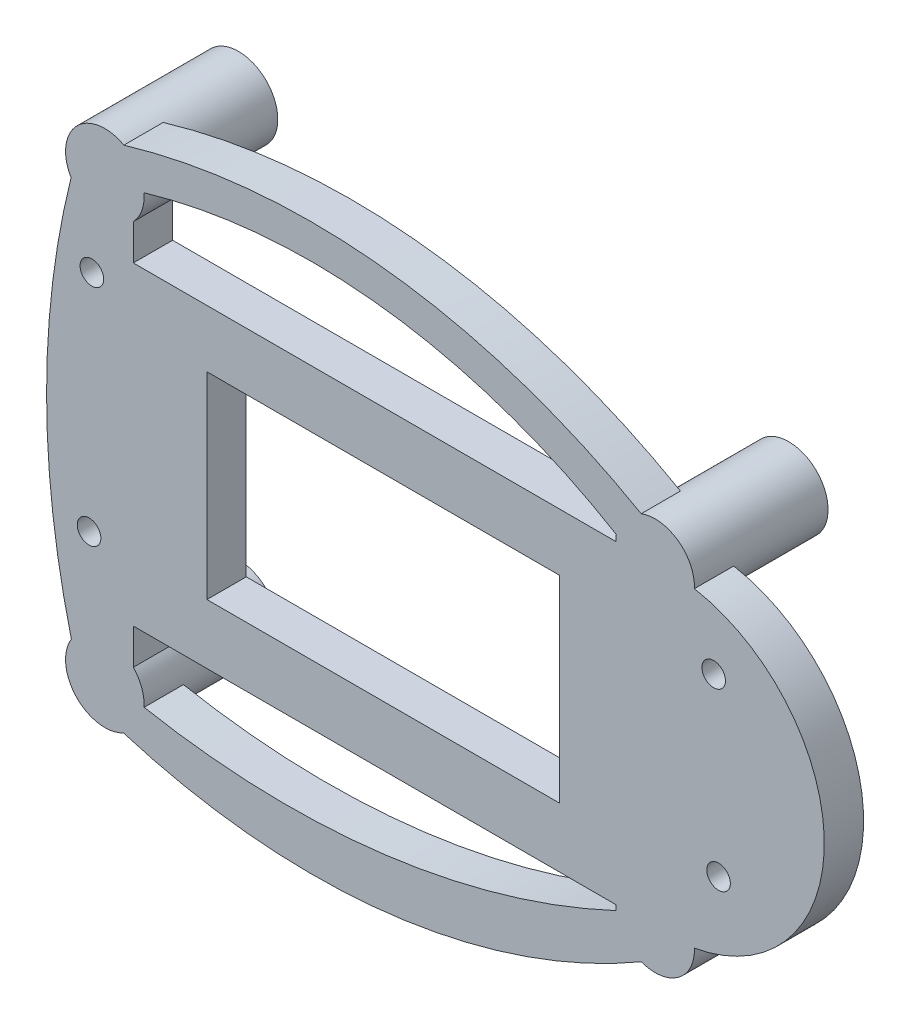
from build123d import *

# Parameters (mm, degrees)
SKETCH1_R                       = 2.6
SKETCH1_R_2                     = 1.5
SKETCH1_W                       = 44.817241247
SKETCH1_H                       = 25.097655098
BOSS_EXTRUDE1_DEPTH             = 5
SKETCH2_R                       = 5
SKETCH2_R_2                     = 2.6
BOSS_EXTRUDE2_DEPTH             = 12
BOSS_EXTRUDE2_DIRECTION_2_REACH = 102.099
BOSS_EXTRUDE3_START             = -10
SKETCH3_R                       = 2.6
BOSS_EXTRUDE3_DEPTH             = 10


with BuildPart() as part:
    # Sketch1 → Boss-Extrude1 (new body)
    with BuildSketch(Plane.XY):
        with BuildLine():
            ThreePointArc((-87.127451531, -22.124820062), (-86.163911981, -24.765644938), (-83.600914186, -25.920377287))
            ThreePointArc((-83.600914186, -25.920377287), (-47.661538714, -29.763777863), (-13.512307499, -17.921462012))
            ThreePointArc((-13.512307499, -17.921462012), (-10.952947302, -16.861340184), (-9.892825615, -14.301979929))
            ThreePointArc((-9.892825615, -14.301979929), (8.007659225, 5.698020071), (-9.892825615, 25.698020071))
            ThreePointArc((-9.892825615, 25.698020071), (-10.952947373, 28.257380397), (-13.512307698, 29.317502154))
            ThreePointArc((-13.512307698, 29.317502154), (-47.63265011, 41.014505592), (-83.512307597, 37.317502154))
            ThreePointArc((-83.512307597, 37.317502154), (-86.071667988, 36.257380433), (-87.131789782, 33.698020071))
            ThreePointArc((-87.131789782, 33.698020071), (-90.927012387, 5.786304892), (-87.127451531, -22.124820062))
        make_face()
        with Locations((-83.512307698, -22.301979929)):
            Circle(SKETCH1_R, mode=Mode.SUBTRACT)
        with Locations((-83.512307698, 33.698020071)):
            Circle(SKETCH1_R, mode=Mode.SUBTRACT)
        with Locations((-13.512307698, 25.698020071)):
            Circle(SKETCH1_R, mode=Mode.SUBTRACT)
        with Locations((-13.512307698, -14.301979929)):
            Circle(SKETCH1_R, mode=Mode.SUBTRACT)
        with Locations((-85.16722268, 22.0113147)):
            Circle(SKETCH1_R_2, mode=Mode.SUBTRACT)
        with Locations((-85.523935714, -6.702744554)):
            Circle(SKETCH1_R_2, mode=Mode.SUBTRACT)
        with Locations((-6.064210345, 17.314888474)):
            Circle(SKETCH1_R_2, mode=Mode.SUBTRACT)
        with Locations((-5.445296778, -4.691116539)):
            Circle(SKETCH1_R_2, mode=Mode.SUBTRACT)
        with BuildLine():
            Line((-79.892825615, -14.301980328), (-79.892825615, -22.301979929))
            ThreePointArc((-79.892825615, -22.301979929), (-47.851158005, -23.48878534), (-17.131789782, -14.301980328))
            Line((-17.131789782, -14.301980328), (-79.892825615, -14.301980328))
        make_face(mode=Mode.SUBTRACT)
        with BuildLine():
            Line((-79.892825615, 33.698019868), (-79.892825615, 25.698020071))
            Line((-79.892825615, 25.698020071), (-17.131789782, 25.698020071))
            ThreePointArc((-17.131789782, 25.698020071), (-47.634119077, 36.587523584), (-79.892825615, 33.698019868))
        make_face(mode=Mode.SUBTRACT)
        with Locations((-48.117941597, 5.846082995)):
            Rectangle(SKETCH1_W, SKETCH1_H, mode=Mode.SUBTRACT)
    extrude(amount=BOSS_EXTRUDE1_DEPTH)

    # Sketch2 → Boss-Extrude2 (add)
    # profile 1 of 4: a face of its own
    with BuildSketch(Plane(origin=(0, 0, 0), x_dir=(-1, 0, 0), z_dir=(0, 0, -1))):
        with Locations((13.512307698, 25.698020071)):
            Circle(SKETCH2_R)
        with Locations((13.512307698, 25.698020071)):
            Circle(SKETCH2_R_2, mode=Mode.SUBTRACT)
    # profile 2 of 4: a face of its own
    with BuildSketch(Plane(origin=(0, 0, 0), x_dir=(-1, 0, 0), z_dir=(0, 0, -1))):
        with Locations((83.512307698, 33.698020071)):
            Circle(SKETCH2_R)
        with Locations((83.512307698, 33.698020071)):
            Circle(SKETCH2_R_2, mode=Mode.SUBTRACT)
    # profile 3 of 4: a face of its own
    with BuildSketch(Plane(origin=(0, 0, 0), x_dir=(-1, 0, 0), z_dir=(0, 0, -1))):
        with Locations((83.512307698, -22.301979929)):
            Circle(SKETCH2_R)
        with Locations((83.512307698, -22.301979929)):
            Circle(SKETCH2_R_2, mode=Mode.SUBTRACT)
    # profile 4 of 4: a face of its own
    with BuildSketch(Plane(origin=(0, 0, 0), x_dir=(-1, 0, 0), z_dir=(0, 0, -1))):
        with Locations((13.512307698, -14.301979929)):
            Circle(SKETCH2_R)
        with Locations((13.512307698, -14.301979929)):
            Circle(SKETCH2_R_2, mode=Mode.SUBTRACT)
    extrude(amount=BOSS_EXTRUDE2_DEPTH)

    # Boss-Extrude2 direction 2: up to this face of the body (flat: up to its plane)
    boss_extrude2_direction_2_end = Plane(part.part.faces().sort_by_distance((-86.07433416, -24.682416176, 5))[0])
    # Sketch2 → Boss-Extrude2 direction 2 (add, up to the picked face)
    with BuildSketch(Plane(origin=(0, 0, 0), x_dir=(-1, 0, 0), z_dir=(0, 0, -1)), mode=Mode.PRIVATE) as boss_extrude2_direction_2_sk1:
        with Locations((13.512307698, 25.698020071)):
            Circle(SKETCH2_R)
        with Locations((13.512307698, 25.698020071)):
            Circle(SKETCH2_R_2, mode=Mode.SUBTRACT)
    boss_extrude2_direction_2_tool1 = split(extrude(boss_extrude2_direction_2_sk1.sketch, amount=-BOSS_EXTRUDE2_DIRECTION_2_REACH, mode=Mode.PRIVATE), bisect_by=boss_extrude2_direction_2_end, keep=Keep.BOTH, mode=Mode.PRIVATE)
    # Sketch2 → Boss-Extrude2 direction 2 (add, up to the picked face)
    with BuildSketch(Plane(origin=(0, 0, 0), x_dir=(-1, 0, 0), z_dir=(0, 0, -1)), mode=Mode.PRIVATE) as boss_extrude2_direction_2_sk2:
        with Locations((83.512307698, 33.698020071)):
            Circle(SKETCH2_R)
        with Locations((83.512307698, 33.698020071)):
            Circle(SKETCH2_R_2, mode=Mode.SUBTRACT)
    boss_extrude2_direction_2_tool2 = split(extrude(boss_extrude2_direction_2_sk2.sketch, amount=-BOSS_EXTRUDE2_DIRECTION_2_REACH, mode=Mode.PRIVATE), bisect_by=boss_extrude2_direction_2_end, keep=Keep.BOTH, mode=Mode.PRIVATE)
    # Sketch2 → Boss-Extrude2 direction 2 (add, up to the picked face)
    with BuildSketch(Plane(origin=(0, 0, 0), x_dir=(-1, 0, 0), z_dir=(0, 0, -1)), mode=Mode.PRIVATE) as boss_extrude2_direction_2_sk3:
        with Locations((83.512307698, -22.301979929)):
            Circle(SKETCH2_R)
        with Locations((83.512307698, -22.301979929)):
            Circle(SKETCH2_R_2, mode=Mode.SUBTRACT)
    boss_extrude2_direction_2_tool3 = split(extrude(boss_extrude2_direction_2_sk3.sketch, amount=-BOSS_EXTRUDE2_DIRECTION_2_REACH, mode=Mode.PRIVATE), bisect_by=boss_extrude2_direction_2_end, keep=Keep.BOTH, mode=Mode.PRIVATE)
    # Sketch2 → Boss-Extrude2 direction 2 (add, up to the picked face)
    with BuildSketch(Plane(origin=(0, 0, 0), x_dir=(-1, 0, 0), z_dir=(0, 0, -1)), mode=Mode.PRIVATE) as boss_extrude2_direction_2_sk4:
        with Locations((13.512307698, -14.301979929)):
            Circle(SKETCH2_R)
        with Locations((13.512307698, -14.301979929)):
            Circle(SKETCH2_R_2, mode=Mode.SUBTRACT)
    boss_extrude2_direction_2_tool4 = split(extrude(boss_extrude2_direction_2_sk4.sketch, amount=-BOSS_EXTRUDE2_DIRECTION_2_REACH, mode=Mode.PRIVATE), bisect_by=boss_extrude2_direction_2_end, keep=Keep.BOTH, mode=Mode.PRIVATE)
    add(boss_extrude2_direction_2_tool1.solids().sort_by(Axis((-8.653729, 25.69802, 0), (0, 0, 1)))[0])
    add(boss_extrude2_direction_2_tool2.solids().sort_by(Axis((-78.653729, 33.69802, 0), (0, 0, 1)))[0])
    add(boss_extrude2_direction_2_tool3.solids().sort_by(Axis((-78.653729, -22.30198, 0), (0, 0, 1)))[0])
    add(boss_extrude2_direction_2_tool4.solids().sort_by(Axis((-8.653729, -14.30198, 0), (0, 0, 1)))[0])

    # Sketch3 → Boss-Extrude3 (add)
    with BuildSketch(Plane.XY.offset(5).offset(BOSS_EXTRUDE3_START)):
        with Locations(Location((-83.512307698, 33.698020071, 0), (0, 0, 180))):
            Circle(SKETCH3_R)
        with Locations(Location((-13.512307698, 25.698020071, 0), (0, 0, 180))):
            Circle(SKETCH3_R)
        with Locations(Location((-13.512307698, -14.301979929, 0), (0, 0, 180))):
            Circle(SKETCH3_R)
        with Locations(Location((-83.512307698, -22.301979929, 0), (0, 0, 180))):
            Circle(SKETCH3_R)
    extrude(amount=BOSS_EXTRUDE3_DEPTH)


solid = part.part
